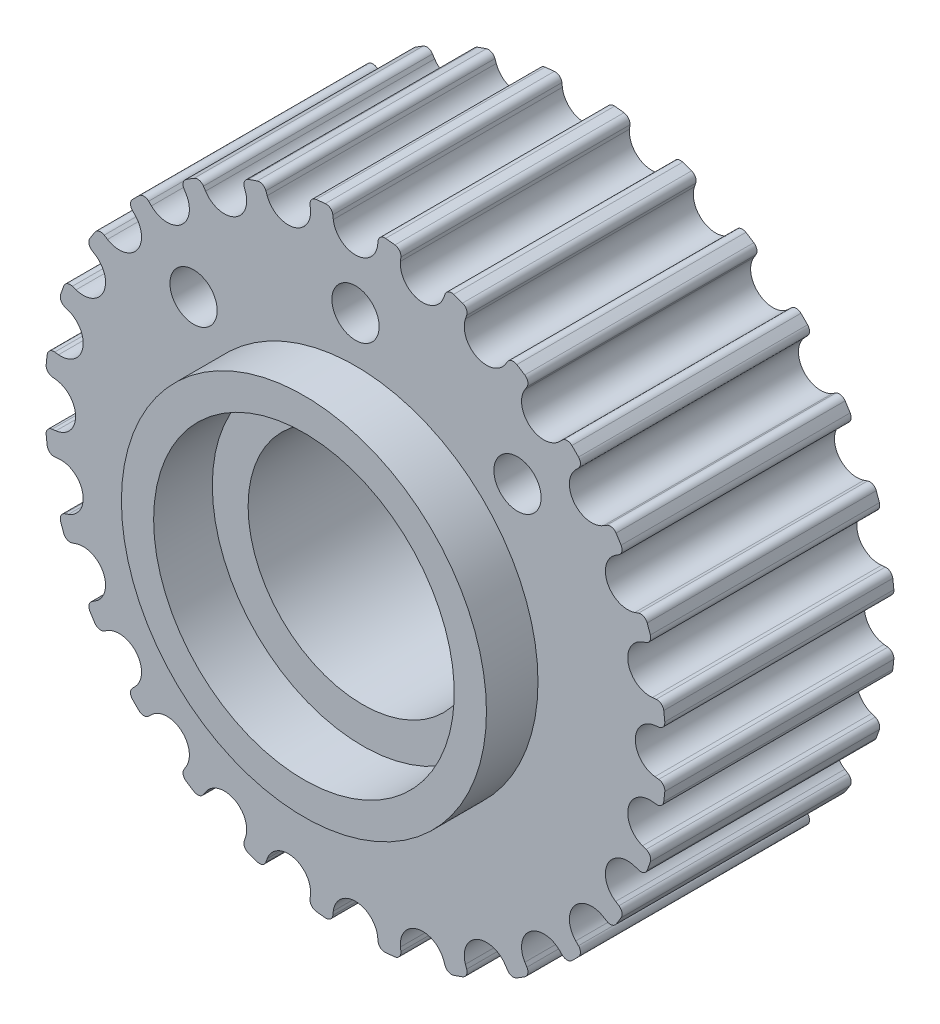
from build123d import *

# Parameters (mm, degrees)
SKETCH_2_R           = 10.5
EXTRUDE_1_DEPTH      = 16
EXTRUDE_2_DEPTH      = 4
EXTRUDE_2_DEPTH_BACK = 18
SKETCH_12_R          = 13
SKETCH_12_R_2        = 11.5
CUT_EXTRUDE_START    = -1.1
SKETCH_14_R          = 11.5
SKETCH_14_R_2        = 10.5
CUT_EXTRUDE_1_DEPTH  = 1.1
SKETCH_16_R          = 11.5
SKETCH_16_R_2        = 10.5
CUT_EXTRUDE_5_DEPTH  = 1.1
SKETCH_20_R          = 11.967322948
EXTRUDE_3_DEPTH      = 22
SKETCH_21_R          = 13
EXTRUDE_4_DEPTH      = 1
SKETCH_22_R          = 11.5
SKETCH_22_R_2        = 8.5
CUT_EXTRUDE_6_DEPTH  = 4.1
SKETCH_23_R          = 8.5
CUT_EXTRUDE_7_DEPTH  = 33.1
CUT_EXTRUDE_START_2  = -4.1
SKETCH_24_R          = 11.5
CUT_EXTRUDE_8_DEPTH  = 4.1
SKETCH_25_R          = 14.35122767
CUT_EXTRUDE_9_DEPTH  = 35
SKETCH_26_R          = 14.867897231
EXTRUDE_5_DEPTH      = 16
SKETCH_27_R          = 8
CUT_EXTRUDE_10_DEPTH = 27
SKETCH_30_R          = 12.75
SKETCH_30_R_2        = 10.5
EXTRUDE_6_DEPTH      = 3.6
CUT_EXTRUDE_START_3  = -0.5
SKETCH_31_R          = 10.5
CUT_EXTRUDE_13_DEPTH = 0.5
SKETCH_18_R          = 1.65
CUT_EXTRUDE_15_DEPTH = 25


with BuildPart() as part:
    # 草图2 → 凸台-拉伸1 (new body)
    with BuildSketch(Plane.XY):
        with BuildLine():
            Line((1.331903556, 20.780403486), (1.298918642, 20.511762921))
            ThreePointArc((1.298918642, 20.511762921), (-0.249453355, 19.141879097), (-1.797825351, 20.511762921))
            Line((-1.797825351, 20.511762921), (-1.830810265, 20.780403486))
            ThreePointArc((-1.830810265, 20.780403486), (-2.006994407, 21.096415396), (-2.353762187, 21.19964565))
            ThreePointArc((-2.353762187, 21.19964565), (-2.679978202, 21.165383749), (-3.00563929, 21.12619674))
            ThreePointArc((-3.00563929, 21.12619674), (-3.320741986, 20.948391594), (-3.422189558, 20.601098103))
            Line((-3.422189558, 20.601098103), (-3.394569322, 20.331853084))
            ThreePointArc((-3.394569322, 20.331853084), (-4.599292572, 18.651769924), (-6.413671477, 19.642762718))
            Line((-6.413671477, 19.642762718), (-6.50560754, 19.897328069))
            ThreePointArc((-6.50560754, 19.897328069), (-6.747693643, 20.166212241), (-7.108738124, 20.189691206))
            ThreePointArc((-7.108738124, 20.189691206), (-7.419151232, 20.083698431), (-7.727927386, 19.973027513))
            ThreePointArc((-7.727927386, 19.973027513), (-7.995564432, 19.729563367), (-8.01718843, 19.36840304))
            Line((-8.01718843, 19.36840304), (-7.930348038, 19.112054636))
            ThreePointArc((-7.930348038, 19.112054636), (-8.731012687, 17.206018527), (-10.720417968, 17.768427773))
            Line((-10.720417968, 17.768427773), (-10.866695121, 17.996152941))
            ThreePointArc((-10.866695121, 17.996152941), (-11.162543977, 18.2044264), (-11.51976088, 18.146976743))
            ThreePointArc((-11.51976088, 18.146976743), (-11.798805672, 17.974568014), (-12.075213567, 17.797962688))
            ThreePointArc((-12.075213567, 17.797962688), (-12.281964525, 17.501047851), (-12.222680631, 17.144130775))
            Line((-12.222680631, 17.144130775), (-12.080974622, 16.913533367))
            ThreePointArc((-12.080974622, 16.913533367), (-12.437432001, 14.877120916), (-14.502106569, 14.982745068))
            Line((-14.502106569, 14.982745068), (-14.695389866, 15.172210962))
            ThreePointArc((-14.695389866, 15.172210962), (-15.030166378, 15.309430006), (-15.365643356, 15.173932493))
            ThreePointArc((-15.365643356, 15.173932493), (-15.599327361, 14.943753103), (-15.829506751, 14.710069098))
            ThreePointArc((-15.829506751, 14.710069098), (-15.965004264, 14.37459212), (-15.82778522, 14.039815608))
            Line((-15.82778522, 14.039815608), (-15.638319326, 13.846532311))
            ThreePointArc((-15.638319326, 13.846532311), (-15.532695174, 11.781857744), (-17.569107624, 11.425400364))
            Line((-17.569107624, 11.425400364), (-17.799705033, 11.567106373))
            ThreePointArc((-17.799705033, 11.567106373), (-18.156622109, 11.626390267), (-18.453536946, 11.41963931))
            ThreePointArc((-18.453536946, 11.41963931), (-18.630142271, 11.143231414), (-18.802551001, 10.864186622))
            ThreePointArc((-18.802551001, 10.864186622), (-18.860000658, 10.506969719), (-18.651727199, 10.211120863))
            Line((-18.651727199, 10.211120863), (-18.424002031, 10.06484371))
            ThreePointArc((-18.424002031, 10.06484371), (-17.861592784, 8.075438429), (-19.767628894, 7.27477378))
            Line((-19.767628894, 7.27477378), (-20.023977298, 7.361614172))
            ThreePointArc((-20.023977298, 7.361614172), (-20.385137624, 7.339990175), (-20.628601771, 7.072353128))
            ThreePointArc((-20.628601771, 7.072353128), (-20.739272689, 6.763576974), (-20.845265464, 6.453163866))
            ThreePointArc((-20.845265464, 6.453163866), (-20.821786499, 6.092119385), (-20.552902327, 5.850033282))
            Line((-20.552902327, 5.850033282), (-20.298336976, 5.75809722))
            ThreePointArc((-20.298336976, 5.75809722), (-19.307344182, 3.943718314), (-20.987427341, 2.738995064))
            Line((-20.987427341, 2.738995064), (-21.25667236, 2.7666153))
            ThreePointArc((-21.25667236, 2.7666153), (-21.603965852, 2.665167728), (-21.781770998, 2.350065032))
            ThreePointArc((-21.781770998, 2.350065032), (-21.820958007, 2.024403944), (-21.855219907, 1.69818793))
            ThreePointArc((-21.855219907, 1.69818793), (-21.751989654, 1.351420149), (-21.435977744, 1.175236007))
            Line((-21.435977744, 1.175236007), (-21.167337179, 1.142251093))
            ThreePointArc((-21.167337179, 1.142251093), (-19.797453355, -0.406120903), (-21.167337179, -1.9544929))
            Line((-21.167337179, -1.9544929), (-21.435977744, -1.987477814))
            ThreePointArc((-21.435977744, -1.987477814), (-21.751989654, -2.163661955), (-21.855219907, -2.510429736))
            ThreePointArc((-21.855219907, -2.510429736), (-21.820958007, -2.83664575), (-21.781770998, -3.162306838))
            ThreePointArc((-21.781770998, -3.162306838), (-21.603965852, -3.477409534), (-21.25667236, -3.578857107))
            Line((-21.25667236, -3.578857107), (-20.987427341, -3.55123687))
            ThreePointArc((-20.987427341, -3.55123687), (-19.307344182, -4.75596012), (-20.298336976, -6.570339026))
            Line((-20.298336976, -6.570339026), (-20.552902327, -6.662275089))
            ThreePointArc((-20.552902327, -6.662275089), (-20.821786499, -6.904361192), (-20.845265464, -7.265405672))
            ThreePointArc((-20.845265464, -7.265405672), (-20.739272689, -7.57581878), (-20.628601771, -7.884594935))
            ThreePointArc((-20.628601771, -7.884594935), (-20.385137624, -8.152231981), (-20.023977298, -8.173855979))
            Line((-20.023977298, -8.173855979), (-19.767628894, -8.087015586))
            ThreePointArc((-19.767628894, -8.087015586), (-17.861592784, -8.887680235), (-18.424002031, -10.877085516))
            Line((-18.424002031, -10.877085516), (-18.651727199, -11.023362669))
            ThreePointArc((-18.651727199, -11.023362669), (-18.860000658, -11.319211525), (-18.802551001, -11.676428428))
            ThreePointArc((-18.802551001, -11.676428428), (-18.630142271, -11.95547322), (-18.453536946, -12.231881116))
            ThreePointArc((-18.453536946, -12.231881116), (-18.156622109, -12.438632073), (-17.799705033, -12.379348179))
            Line((-17.799705033, -12.379348179), (-17.569107624, -12.237642171))
            ThreePointArc((-17.569107624, -12.237642171), (-15.532695174, -12.59409955), (-15.638319326, -14.658774118))
            Line((-15.638319326, -14.658774118), (-15.82778522, -14.852057414))
            ThreePointArc((-15.82778522, -14.852057414), (-15.965004264, -15.186833926), (-15.829506751, -15.522310905))
            ThreePointArc((-15.829506751, -15.522310905), (-15.599327361, -15.755994909), (-15.365643356, -15.9861743))
            ThreePointArc((-15.365643356, -15.9861743), (-15.030166378, -16.121671812), (-14.695389866, -15.984452768))
            Line((-14.695389866, -15.984452768), (-14.502106569, -15.794986874))
            ThreePointArc((-14.502106569, -15.794986874), (-12.437432001, -15.689362722), (-12.080974622, -17.725775173))
            Line((-12.080974622, -17.725775173), (-12.222680631, -17.956372582))
            ThreePointArc((-12.222680631, -17.956372582), (-12.281964525, -18.313289657), (-12.075213567, -18.610204494))
            ThreePointArc((-12.075213567, -18.610204494), (-11.798805672, -18.78680982), (-11.51976088, -18.95921855))
            ThreePointArc((-11.51976088, -18.95921855), (-11.162543977, -19.016668206), (-10.866695121, -18.808394748))
            Line((-10.866695121, -18.808394748), (-10.720417968, -18.58066958))
            ThreePointArc((-10.720417968, -18.58066958), (-8.731012687, -18.018260333), (-7.930348038, -19.924296443))
            Line((-7.930348038, -19.924296443), (-8.01718843, -20.180644846))
            ThreePointArc((-8.01718843, -20.180644846), (-7.995564432, -20.541805173), (-7.727927386, -20.785269319))
            ThreePointArc((-7.727927386, -20.785269319), (-7.419151232, -20.895940238), (-7.108738124, -21.001933013))
            ThreePointArc((-7.108738124, -21.001933013), (-6.747693643, -20.978454047), (-6.50560754, -20.709569876))
            Line((-6.50560754, -20.709569876), (-6.413671477, -20.455004524))
            ThreePointArc((-6.413671477, -20.455004524), (-4.599292572, -19.464011731), (-3.394569322, -21.14409489))
            Line((-3.394569322, -21.14409489), (-3.422189558, -21.413339909))
            ThreePointArc((-3.422189558, -21.413339909), (-3.320741986, -21.7606334), (-3.00563929, -21.938438546))
            ThreePointArc((-3.00563929, -21.938438546), (-2.679978202, -21.977625556), (-2.353762187, -22.011887456))
            ThreePointArc((-2.353762187, -22.011887456), (-2.006994407, -21.908657202), (-1.830810265, -21.592645292))
            Line((-1.830810265, -21.592645292), (-1.797825351, -21.324004727))
            ThreePointArc((-1.797825351, -21.324004727), (-0.249453355, -19.954120903), (1.298918642, -21.324004727))
            Line((1.298918642, -21.324004727), (1.331903556, -21.592645292))
            ThreePointArc((1.331903556, -21.592645292), (1.508087698, -21.908657202), (1.854855478, -22.011887456))
            ThreePointArc((1.854855478, -22.011887456), (2.181071493, -21.977625556), (2.506732581, -21.938438546))
            ThreePointArc((2.506732581, -21.938438546), (2.821835276, -21.7606334), (2.923282849, -21.413339909))
            Line((2.923282849, -21.413339909), (2.895662612, -21.14409489))
            ThreePointArc((2.895662612, -21.14409489), (4.100385862, -19.464011731), (5.914764768, -20.455004524))
            Line((5.914764768, -20.455004524), (6.006700831, -20.709569876))
            ThreePointArc((6.006700831, -20.709569876), (6.248786934, -20.978454047), (6.609831415, -21.001933013))
            ThreePointArc((6.609831415, -21.001933013), (6.920244522, -20.895940238), (7.229020677, -20.785269319))
            ThreePointArc((7.229020677, -20.785269319), (7.496657723, -20.541805173), (7.518281721, -20.180644846))
            Line((7.518281721, -20.180644846), (7.431441329, -19.924296443))
            ThreePointArc((7.431441329, -19.924296443), (8.232105978, -18.018260333), (10.221511258, -18.58066958))
            Line((10.221511258, -18.58066958), (10.367788412, -18.808394748))
            ThreePointArc((10.367788412, -18.808394748), (10.663637267, -19.016668206), (11.020854171, -18.95921855))
            ThreePointArc((11.020854171, -18.95921855), (11.299898962, -18.78680982), (11.576306858, -18.610204494))
            ThreePointArc((11.576306858, -18.610204494), (11.783057816, -18.313289657), (11.723773921, -17.956372582))
            Line((11.723773921, -17.956372582), (11.582067913, -17.725775173))
            ThreePointArc((11.582067913, -17.725775173), (11.938525292, -15.689362722), (14.00319986, -15.794986874))
            Line((14.00319986, -15.794986874), (14.196483156, -15.984452768))
            ThreePointArc((14.196483156, -15.984452768), (14.531259668, -16.121671812), (14.866736647, -15.9861743))
            ThreePointArc((14.866736647, -15.9861743), (15.100420651, -15.755994909), (15.330600042, -15.522310905))
            ThreePointArc((15.330600042, -15.522310905), (15.466097554, -15.186833926), (15.32887851, -14.852057414))
            Line((15.32887851, -14.852057414), (15.139412616, -14.658774118))
            ThreePointArc((15.139412616, -14.658774118), (15.033788465, -12.59409955), (17.070200915, -12.237642171))
            Line((17.070200915, -12.237642171), (17.300798324, -12.379348179))
            ThreePointArc((17.300798324, -12.379348179), (17.657715399, -12.438632073), (17.954630236, -12.231881116))
            ThreePointArc((17.954630236, -12.231881116), (18.131235562, -11.95547322), (18.303644292, -11.676428428))
            ThreePointArc((18.303644292, -11.676428428), (18.361093948, -11.319211525), (18.15282049, -11.023362669))
            Line((18.15282049, -11.023362669), (17.925095322, -10.877085516))
            ThreePointArc((17.925095322, -10.877085516), (17.362686075, -8.887680235), (19.268722185, -8.087015586))
            Line((19.268722185, -8.087015586), (19.525070588, -8.173855979))
            ThreePointArc((19.525070588, -8.173855979), (19.886230915, -8.152231981), (20.129695061, -7.884594935))
            ThreePointArc((20.129695061, -7.884594935), (20.24036598, -7.57581878), (20.346358755, -7.265405672))
            ThreePointArc((20.346358755, -7.265405672), (20.32287979, -6.904361192), (20.053995618, -6.662275089))
            Line((20.053995618, -6.662275089), (19.799430267, -6.570339026))
            ThreePointArc((19.799430267, -6.570339026), (18.808437473, -4.75596012), (20.488520632, -3.55123687))
            Line((20.488520632, -3.55123687), (20.757765651, -3.578857107))
            ThreePointArc((20.757765651, -3.578857107), (21.105059142, -3.477409534), (21.282864289, -3.162306838))
            ThreePointArc((21.282864289, -3.162306838), (21.322051298, -2.83664575), (21.356313198, -2.510429736))
            ThreePointArc((21.356313198, -2.510429736), (21.253082944, -2.163661955), (20.937071035, -1.987477814))
            Line((20.937071035, -1.987477814), (20.66843047, -1.9544929))
            ThreePointArc((20.66843047, -1.9544929), (19.298546645, -0.406120903), (20.66843047, 1.142251093))
            Line((20.66843047, 1.142251093), (20.937071035, 1.175236007))
            ThreePointArc((20.937071035, 1.175236007), (21.253082944, 1.351420149), (21.356313198, 1.69818793))
            ThreePointArc((21.356313198, 1.69818793), (21.322051298, 2.024403944), (21.282864289, 2.350065032))
            ThreePointArc((21.282864289, 2.350065032), (21.105059142, 2.665167728), (20.757765651, 2.7666153))
            Line((20.757765651, 2.7666153), (20.488520632, 2.738995064))
            ThreePointArc((20.488520632, 2.738995064), (18.808437473, 3.943718314), (19.799430267, 5.75809722))
            Line((19.799430267, 5.75809722), (20.053995618, 5.850033282))
            ThreePointArc((20.053995618, 5.850033282), (20.32287979, 6.092119385), (20.346358755, 6.453163866))
            ThreePointArc((20.346358755, 6.453163866), (20.24036598, 6.763576974), (20.129695061, 7.072353128))
            ThreePointArc((20.129695061, 7.072353128), (19.886230915, 7.339990175), (19.525070588, 7.361614172))
            Line((19.525070588, 7.361614172), (19.268722185, 7.27477378))
            ThreePointArc((19.268722185, 7.27477378), (17.362686075, 8.075438429), (17.925095322, 10.06484371))
            Line((17.925095322, 10.06484371), (18.15282049, 10.211120863))
            ThreePointArc((18.15282049, 10.211120863), (18.361093948, 10.506969719), (18.303644292, 10.864186622))
            ThreePointArc((18.303644292, 10.864186622), (18.131235562, 11.143231414), (17.954630236, 11.41963931))
            ThreePointArc((17.954630236, 11.41963931), (17.657715399, 11.626390267), (17.300798324, 11.567106373))
            Line((17.300798324, 11.567106373), (17.070200915, 11.425400364))
            ThreePointArc((17.070200915, 11.425400364), (15.033788465, 11.781857744), (15.139412616, 13.846532311))
            Line((15.139412616, 13.846532311), (15.32887851, 14.039815608))
            ThreePointArc((15.32887851, 14.039815608), (15.466097554, 14.37459212), (15.330600042, 14.710069098))
            ThreePointArc((15.330600042, 14.710069098), (15.100420651, 14.943753103), (14.866736647, 15.173932493))
            ThreePointArc((14.866736647, 15.173932493), (14.531259668, 15.309430006), (14.196483156, 15.172210962))
            Line((14.196483156, 15.172210962), (14.00319986, 14.982745068))
            ThreePointArc((14.00319986, 14.982745068), (11.938525292, 14.877120916), (11.582067913, 16.913533367))
            Line((11.582067913, 16.913533367), (11.723773921, 17.144130775))
            ThreePointArc((11.723773921, 17.144130775), (11.783057816, 17.501047851), (11.576306858, 17.797962688))
            ThreePointArc((11.576306858, 17.797962688), (11.299898962, 17.974568014), (11.020854171, 18.146976743))
            ThreePointArc((11.020854171, 18.146976743), (10.663637267, 18.2044264), (10.367788412, 17.996152941))
            Line((10.367788412, 17.996152941), (10.221511258, 17.768427773))
            ThreePointArc((10.221511258, 17.768427773), (8.232105978, 17.206018527), (7.431441329, 19.112054636))
            Line((7.431441329, 19.112054636), (7.518281721, 19.36840304))
            ThreePointArc((7.518281721, 19.36840304), (7.496657723, 19.729563367), (7.229020677, 19.973027513))
            ThreePointArc((7.229020677, 19.973027513), (6.920244522, 20.083698431), (6.609831415, 20.189691206))
            ThreePointArc((6.609831415, 20.189691206), (6.248786934, 20.166212241), (6.006700831, 19.897328069))
            Line((6.006700831, 19.897328069), (5.914764768, 19.642762718))
            ThreePointArc((5.914764768, 19.642762718), (4.100385862, 18.651769924), (2.895662612, 20.331853084))
            Line((2.895662612, 20.331853084), (2.923282849, 20.601098103))
            ThreePointArc((2.923282849, 20.601098103), (2.821835276, 20.948391594), (2.506732581, 21.12619674))
            ThreePointArc((2.506732581, 21.12619674), (2.181071493, 21.165383749), (1.854855478, 21.19964565))
            ThreePointArc((1.854855478, 21.19964565), (1.508087698, 21.096415396), (1.331903556, 20.780403486))
        make_face()
        with Locations((-0.245789015, -0.367741944)):
            Circle(SKETCH_2_R, mode=Mode.SUBTRACT)
    extrude(amount=EXTRUDE_1_DEPTH)


with BuildPart() as part_1:
    # Move Body 1: moved
    add(part.part.moved(Location((-21.775119277, 0, 0))))

    # 草图12 → 凸台-拉伸2 (add, two sides: drawn at the far end of the back side and taken through both)
    with BuildSketch(Plane.XY.offset(16).offset(-EXTRUDE_2_DEPTH_BACK)):
        with Locations((-22.024572632, -0.309578045)):
            Circle(SKETCH_12_R)
        with Locations((-22.024572632, -0.309578045)):
            Circle(SKETCH_12_R_2, mode=Mode.SUBTRACT)
    extrude(amount=EXTRUDE_2_DEPTH + EXTRUDE_2_DEPTH_BACK)

    # 草图14 → 切除-拉伸1 (cut)
    with BuildSketch(Plane.XY.offset(16).offset(CUT_EXTRUDE_START)):
        with Locations((-22.024572632, -0.309578045)):
            Circle(SKETCH_14_R)
        with Locations((-22.020908292, -0.367741944)):
            Circle(SKETCH_14_R_2, mode=Mode.SUBTRACT)
    extrude(amount=CUT_EXTRUDE_1_DEPTH, mode=Mode.SUBTRACT)

    # 草图16 → 切除-拉伸5 (cut)
    with BuildSketch(Plane(origin=(0, 0, 0), x_dir=(-1, 0, 0), z_dir=(0, 0, -1))):
        with Locations(Location((22.024572632, -0.309578045, 0), (0, 0, 180))):
            Circle(SKETCH_16_R)
        with Locations((22.020908292, -0.367741944)):
            Circle(SKETCH_16_R_2, mode=Mode.SUBTRACT)
    extrude(amount=-CUT_EXTRUDE_5_DEPTH, mode=Mode.SUBTRACT)

    # 草图20 → 凸台-拉伸3 (add)
    with BuildSketch(Plane.XY.offset(20)):
        with Locations((-22.024572632, -0.309578045)):
            Circle(SKETCH_20_R)
    extrude(amount=-EXTRUDE_3_DEPTH)

    # 草图21 → 凸台-拉伸4 (add)
    with BuildSketch(Plane(origin=(0, 0, -2), x_dir=(-1, 0, 0), z_dir=(0, 0, -1))):
        with Locations(Location((22.024572632, -0.309578045, 0), (0, 0, 180))):
            Circle(SKETCH_21_R)
    extrude(amount=EXTRUDE_4_DEPTH)

    # 草图22 → 切除-拉伸6 (cut)
    with BuildSketch(Plane(origin=(0, 0, -3), x_dir=(-1, 0, 0), z_dir=(0, 0, -1))):
        with Locations((22.024572632, -0.309578045)):
            Circle(SKETCH_22_R)
        with Locations((22.024572632, -0.309578045)):
            Circle(SKETCH_22_R_2, mode=Mode.SUBTRACT)
    extrude(amount=-CUT_EXTRUDE_6_DEPTH, mode=Mode.SUBTRACT)

    # 草图23 → 切除-拉伸7 (cut)
    with BuildSketch(Plane(origin=(0, 0, -3), x_dir=(-1, 0, 0), z_dir=(0, 0, -1))):
        with Locations((22.024572632, -0.309578045)):
            Circle(SKETCH_23_R)
    extrude(amount=-CUT_EXTRUDE_7_DEPTH, mode=Mode.SUBTRACT)

    # 草图24 → 切除-拉伸8 (cut)
    with BuildSketch(Plane.XY.offset(20).offset(CUT_EXTRUDE_START_2)):
        with Locations(Location((-22.024572632, -0.309578045, 0), (0, 0, 180))):
            Circle(SKETCH_24_R)
    extrude(amount=CUT_EXTRUDE_8_DEPTH, mode=Mode.SUBTRACT)

    # 草图25 → 切除-拉伸9 (cut)
    with BuildSketch(Plane(origin=(0, 0, -3), x_dir=(-1, 0, 0), z_dir=(0, 0, -1))):
        with Locations(Location((22.024572632, -0.309578045, 0), (0, 0, 180))):
            Circle(SKETCH_25_R)
    extrude(amount=-CUT_EXTRUDE_9_DEPTH, mode=Mode.SUBTRACT)

    # 草图26 → 凸台-拉伸5 (add)
    with BuildSketch(Plane(origin=(0, 0, 0), x_dir=(-1, 0, 0), z_dir=(0, 0, -1))):
        with Locations((22.024572632, -0.309578045)):
            Circle(SKETCH_26_R)
    extrude(amount=-EXTRUDE_5_DEPTH)

    # 草图27 → 切除-拉伸10 (cut)
    with BuildSketch(Plane(origin=(0, 0, 0), x_dir=(-1, 0, 0), z_dir=(0, 0, -1))):
        with Locations((22.024572632, -0.309578045)):
            Circle(SKETCH_27_R)
    extrude(amount=-CUT_EXTRUDE_10_DEPTH, mode=Mode.SUBTRACT)

    # 草图30 → 凸台-拉伸6 (add)
    with BuildSketch(Plane(origin=(0, 0, 0), x_dir=(-1, 0, 0), z_dir=(0, 0, -1))):
        with Locations(Location((22.024572632, -0.309578045, 0), (0, 0, 180))):
            Circle(SKETCH_30_R)
        with Locations((22.024572632, -0.309578045)):
            Circle(SKETCH_30_R_2, mode=Mode.SUBTRACT)
    extrude_6 = extrude(amount=EXTRUDE_6_DEPTH)

    # 草图31 → 切除-拉伸13 (cut)
    with BuildSketch(Plane(origin=(0, 0, 0), x_dir=(-1, 0, 0), z_dir=(0, 0, -1)).offset(CUT_EXTRUDE_START_3)):
        with Locations((22.024572632, -0.309578045)):
            Circle(SKETCH_31_R)
    cut_extrude_13 = extrude(amount=CUT_EXTRUDE_13_DEPTH, mode=Mode.SUBTRACT)

    # 镜向2: 凸台-拉伸6, 切除-拉伸13 across plane
    add(extrude_6.mirror(Plane(origin=(0, 0, 8), x_dir=(1, 0, 0), z_dir=(0, 0, -1))))
    add(cut_extrude_13.mirror(Plane(origin=(0, 0, 8), x_dir=(1, 0, 0), z_dir=(0, 0, -1))), mode=Mode.SUBTRACT)

    # 草图18 → 切除-拉伸15 (cut)
    with BuildSketch(Plane(origin=(0, 0, 0), x_dir=(-1, 0, 0), z_dir=(0, 0, -1))):
        with Locations((10.707199793, 10.945966555)):
            Circle(SKETCH_18_R)
        with Locations((22.020908292, 15.632258056)):
            Circle(SKETCH_18_R)
        with Locations((33.334616791, 10.945966555)):
            Circle(SKETCH_18_R)
    extrude(amount=-CUT_EXTRUDE_15_DEPTH, mode=Mode.SUBTRACT)


solid = part_1.part
